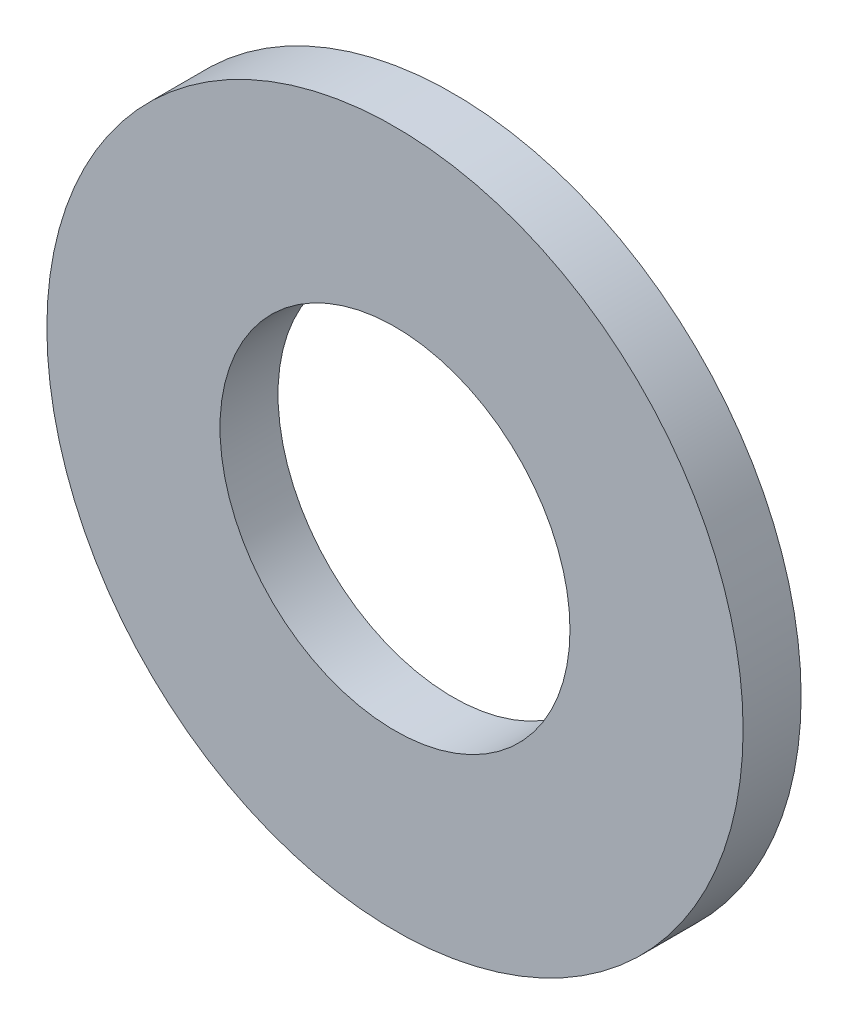
from build123d import *

# Parameters (mm, degrees)
SKETCH1_R      = 9.525
SKETCH1_R_2    = 4.7879
EXTRUDE1_DEPTH = 0.79375


with BuildPart() as part:
    # Sketch1 → Extrude1 (new, symmetric)
    with BuildSketch(Plane.XY):
        Circle(SKETCH1_R)
        Circle(SKETCH1_R_2, mode=Mode.SUBTRACT)
    extrude(amount=EXTRUDE1_DEPTH, both=True)


solid = part.part
